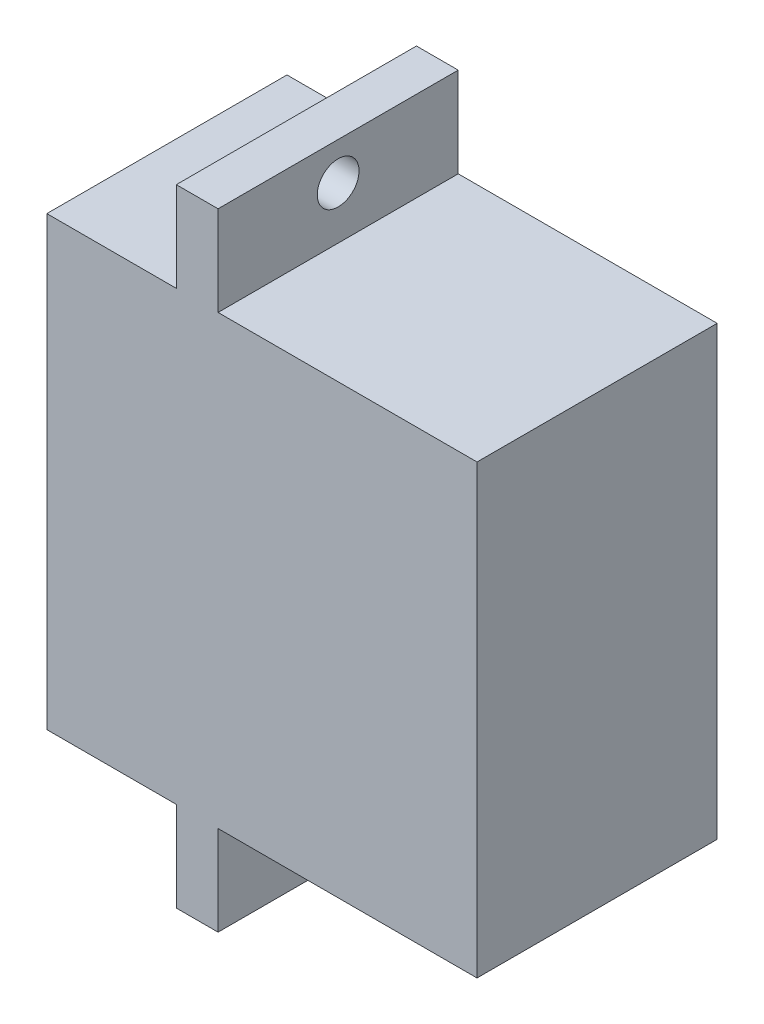
from build123d import *

# Parameters (mm, degrees)
EXTRUDE_START                = 29.8
SKETCH_1_W                   = 11.5
SKETCH_1_H                   = 21.4
EXTRUDE_21_4X11_5_20_6_DEPTH = 20.6
EXTRUDE_START_2              = 36
SKETCH_2_W                   = 11.5
SKETCH_2_H                   = 30
SKETCH_2_R                   = 1
EXTRUDE_30_26_4_2_2_DEPTH    = 2
EXTRUDE_START_3              = 27
SKETCH_3_R                   = 2.5
EXTRUDE_5_2_8_DEPTH          = 2.8


with BuildPart() as part:
    # 草图1 → 机身21.4x11.5_总高20.6 (new body)
    with BuildSketch(Plane(origin=(0, 0, 0), x_dir=(0, 0, -1), z_dir=(1, 0, 0)).offset(EXTRUDE_START)):
        with Locations((3.5, -4.95)):
            Rectangle(SKETCH_1_W, SKETCH_1_H)
    extrude(amount=EXTRUDE_21_4X11_5_20_6_DEPTH)

    # 草图2 → 安装耳30_孔距26.4_孔径2_耳厚暂定2 (add)
    with BuildSketch(Plane(origin=(0, 0, 0), x_dir=(0, 0, -1), z_dir=(1, 0, 0)).offset(EXTRUDE_START_2)):
        with Locations((3.5, -4.95)):
            Rectangle(SKETCH_2_W, SKETCH_2_H)
        with Locations((3.5, -18.15)):
            Circle(SKETCH_2_R, mode=Mode.SUBTRACT)
        with Locations((3.5, 8.25)):
            Circle(SKETCH_2_R, mode=Mode.SUBTRACT)
    extrude(amount=EXTRUDE_30_26_4_2_2_DEPTH)

    # 草图3 → 输出齿轴简化_直径5高2.8待实测 (add)
    with BuildSketch(Plane(origin=(0, 0, 0), x_dir=(0, 0, -1), z_dir=(1, 0, 0)).offset(EXTRUDE_START_3)):
        with Locations((3.5, 0)):
            Circle(SKETCH_3_R)
    extrude(amount=EXTRUDE_5_2_8_DEPTH)


solid = part.part
